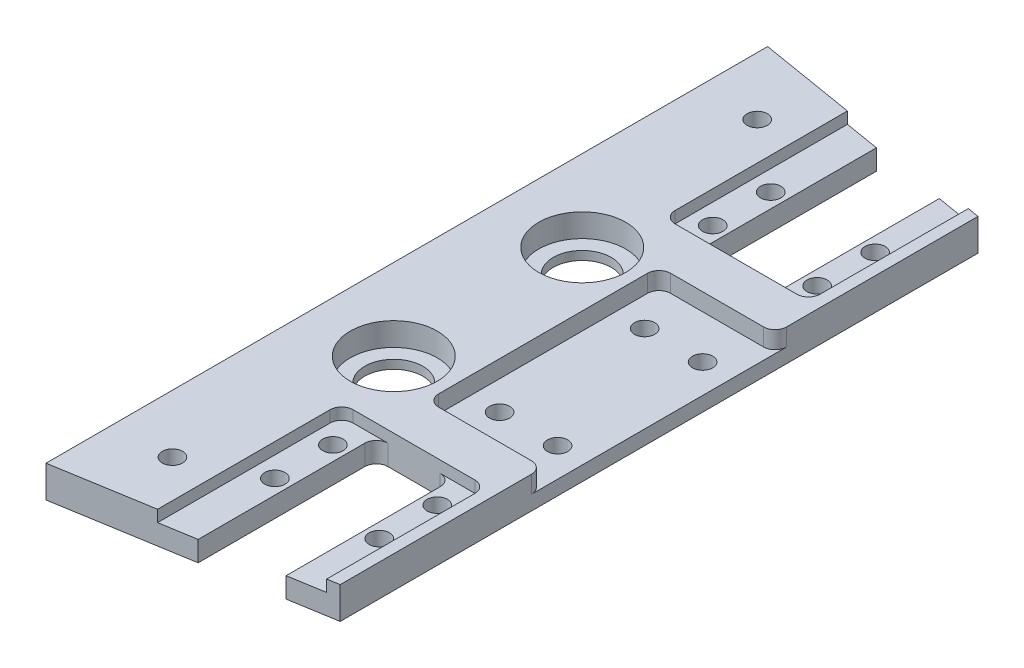
from build123d import *

# Parameters (mm, degrees)
SKETCH_1_W           = 35
SKETCH_1_H           = 55
EXTRUDE_1_DEPTH      = 1
EXTRUDE_2_DEPTH      = 3
SKETCH_3_R           = 5
CUT_EXTRUDE_1_DEPTH  = 169.569903897
SKETCH_4_R           = 4
CUT_EXTRUDE_2_DEPTH  = 2
SKETCH_5_R           = 2
CUT_EXTRUDE_3_DEPTH  = 2
EXTRUDE_START        = 7
EXTRUDE_3_DEPTH      = 7
CUT_EXTRUDE_START    = -1.5
SKETCH_9_W           = 10
SKETCH_9_H           = 26
CUT_EXTRUDE_4_DEPTH  = 168.318874833
SKETCH_10_R          = 1.5
CUT_EXTRUDE_5_DEPTH  = 194.595583627
EXTRUDE_START_2      = -3
EXTRUDE_4_DEPTH      = 3
SKETCH_12_R          = 9
SKETCH_12_R_2        = 5
EXTRUDE_5_DEPTH      = 2.5
SKETCH_13_R          = 7.5
CUT_EXTRUDE_6_DEPTH  = 4
SKETCH_14_W          = 10
SKETCH_14_H          = 26
CUT_EXTRUDE_7_DEPTH  = 2
EXTRUDE_START_3      = -1
EXTRUDE_6_DEPTH      = 2
CUT_EXTRUDE_8_DEPTH  = 170.92003224
SKETCH_17_W          = 35
SKETCH_17_H          = 55
CUT_EXTRUDE_9_DEPTH  = 1
SKETCH_19_R          = 9
EXTRUDE_8_DEPTH      = 2.5
SKETCH_20_W          = 13
SKETCH_20_H          = 1.5
EXTRUDE_9_DEPTH      = 5.5
SKETCH_21_R          = 3.5
CUT_EXTRUDE_10_DEPTH = 2
CUT_EXTRUDE_11_DEPTH = 10
SKETCH_23_R          = 1.75
CUT_EXTRUDE_12_DEPTH = 10
SKETCH_25_R          = 1.75
CUT_EXTRUDE_14_DEPTH = 170.71466453
SKETCH_26_R          = 1
CUT_EXTRUDE_15_DEPTH = 10
SKETCH_27_W          = 202.73966265
SKETCH_27_H          = 59.810399393
CUT_EXTRUDE_16_DEPTH = 188.307580884
SKETCH_28_W          = 40
SKETCH_28_H          = 3
CUT_EXTRUDE_17_DEPTH = 20
SKETCH_29_R          = 1.75
CUT_EXTRUDE_18_DEPTH = 10
EXTRUDE_START_4      = -5.5
EXTRUDE_10_DEPTH     = 5.5
FILLET_1_R           = 2
FILLET_3_R           = 2


with BuildPart() as part:
    # 草图1 → 凸台-拉伸1 (new body)
    with BuildSketch(Plane(origin=(0, 0, 0), x_dir=(1, 0, 0), z_dir=(0, 1, 0))):
        Rectangle(SKETCH_1_W, SKETCH_1_H)
    extrude(amount=EXTRUDE_1_DEPTH)

    # 草图2 → 凸台-拉伸2 (add)
    with BuildSketch(Plane(origin=(0, 1, 0), x_dir=(1, 0, 0), z_dir=(0, 1, 0))):
        with BuildLine():
            Line((106.75, -2.25), (106.75, 2.25))
            Line((106.75, 2.25), (121.75, 2.25))
            ThreePointArc((121.75, 2.25), (122.922125199, 2.352547667), (124.058635967, 2.65707481))
            Line((124.058635967, 2.65707481), (154.058635967, 13.576181838))
            ThreePointArc((154.058635967, 13.576181838), (158.397452333, 21.091232227), (151.75, 26.669107028))
            Line((151.75, 26.669107028), (-31.447415548, 57.101298968))
            ThreePointArc((-31.447415548, 57.101298968), (-37.800418235, 56.264673928), (-42.609265279, 52.029632639))
            Line((-42.609265279, 52.029632639), (-60.161792173, 23.605896086))
            ThreePointArc((-60.161792173, 23.605896086), (-61.717833724, 20.073278016), (-62.25, 16.25))
            Line((-62.25, 16.25), (-62.25, -16.25))
            ThreePointArc((-62.25, -16.25), (-61.717833724, -20.073278016), (-60.161792173, -23.605896086))
            Line((-60.161792173, -23.605896086), (-42.609265279, -52.029632639))
            ThreePointArc((-42.609265279, -52.029632639), (-37.800418235, -56.264673928), (-31.447415548, -57.101298968))
            Line((-31.447415548, -57.101298968), (151.75, -26.669107028))
            ThreePointArc((151.75, -26.669107028), (158.397452333, -21.091232227), (154.058635967, -13.576181838))
            Line((154.058635967, -13.576181838), (124.058635967, -2.65707481))
            ThreePointArc((124.058635967, -2.65707481), (122.922125199, -2.352547667), (121.75, -2.25))
            Line((121.75, -2.25), (106.75, -2.25))
        make_face()
    extrude(amount=EXTRUDE_2_DEPTH)

    # 草图3 → 切除-拉伸1 (cut, through all)
    with BuildSketch(Plane(origin=(0, 4, 0), x_dir=(1, 0, 0), z_dir=(0, 1, 0))):
        with Locations(Location((-48.25, 16.25, 0), (0, 0, 270))):
            Circle(SKETCH_3_R)
        with Locations(Location((-48.25, -16.25, 0), (0, 0, 270))):
            Circle(SKETCH_3_R)
    extrude(amount=-CUT_EXTRUDE_1_DEPTH, mode=Mode.SUBTRACT)

    # 草图4 → 切除-拉伸2 (cut)
    with BuildSketch(Plane(origin=(0, 4, 0), x_dir=(1, 0, 0), z_dir=(0, 1, 0))):
        with Locations(Location((-33.25, 46.25, 0), (0, 0, 270))):
            Circle(SKETCH_4_R)
        with Locations(Location((-33.25, -46.25, 0), (0, 0, 270))):
            Circle(SKETCH_4_R)
    extrude(amount=-CUT_EXTRUDE_2_DEPTH, mode=Mode.SUBTRACT)

    # 草图5 → 切除-拉伸3 (cut)
    with BuildSketch(Plane(origin=(0, 4, 0), x_dir=(1, 0, 0), z_dir=(0, 1, 0))):
        with Locations(Location((121.75, 9, 0), (0, 0, 270))):
            Circle(SKETCH_5_R)
        with Locations(Location((121.75, -9, 0), (0, 0, 270))):
            Circle(SKETCH_5_R)
        with Locations(Location((151.75, 19.919107028, 0), (0, 0, 270))):
            Circle(SKETCH_5_R)
        with Locations(Location((151.75, -19.919107028, 0), (0, 0, 270))):
            Circle(SKETCH_5_R)
    extrude(amount=-CUT_EXTRUDE_3_DEPTH, mode=Mode.SUBTRACT)

    # 草图8 → 凸台-拉伸3 (add)
    with BuildSketch(Plane.XZ.offset(-1).offset(EXTRUDE_START)):
        with BuildLine():
            Line((-26.75, -26.25), (-39.75, -26.25))
            Line((-39.75, -26.25), (-39.75, -55.124119675))
            ThreePointArc((-39.75, -55.124119675), (-35.798281322, -56.950759894), (-31.447415548, -57.101298968))
            Line((-31.447415548, -57.101298968), (-26.75, -56.320978726))
            Line((-26.75, -56.320978726), (-26.75, -26.25))
        make_face()
    extrude_3 = extrude(amount=-EXTRUDE_3_DEPTH)

    # 镜向1: 凸台-拉伸3 across plane
    add(extrude_3.mirror(Plane.XY))

    # 草图9 → 切除-拉伸4 (cut, through all)
    with BuildSketch(Plane.XZ.offset(6).offset(CUT_EXTRUDE_START)):
        with Locations((-33.25, -40.75)):
            Rectangle(SKETCH_9_W, SKETCH_9_H)
    cut_extrude_4 = extrude(amount=-CUT_EXTRUDE_4_DEPTH, mode=Mode.SUBTRACT)

    # 镜向2: 切除-拉伸4 across plane
    add(cut_extrude_4.mirror(Plane.XY), mode=Mode.SUBTRACT)

    # 草图10 → 切除-拉伸5 (cut, through all)
    with BuildSketch(Plane.XY.offset(-53.75)):
        with Locations((-33.25, -1.5)):
            Circle(SKETCH_10_R)
    cut_extrude_5 = extrude(amount=-CUT_EXTRUDE_5_DEPTH, mode=Mode.SUBTRACT)

    # 镜向3: 切除-拉伸5 across plane
    add(cut_extrude_5.mirror(Plane.XY), mode=Mode.SUBTRACT)

    # 草图11 → 凸台-拉伸4 (add)
    with BuildSketch(Plane(origin=(0, 4, 0), x_dir=(1, 0, 0), z_dir=(0, 1, 0)).offset(EXTRUDE_START_2)):
        with BuildLine():
            Line((-62.25, 50.419925161), (-62.25, 16.25))
            ThreePointArc((-62.25, 16.25), (-61.717833724, 20.073278016), (-60.161792173, 23.605896086))
            Line((-60.161792173, 23.605896086), (-42.609265279, 52.029632639))
            ThreePointArc((-42.609265279, 52.029632639), (-37.800418235, 56.264673928), (-31.447415548, 57.101298968))
            Line((-31.447415548, 57.101298968), (-50.611286861, 60.284742405))
            ThreePointArc((-50.611286861, 60.284742405), (-58.715789535, 58.048395892), (-62.25, 50.419925161))
        make_face()
        with BuildLine():
            ThreePointArc((-60.161792173, -23.605896086), (-61.717833724, -20.073278016), (-62.25, -16.25))
            Line((-62.25, -16.25), (-62.25, -50.419925161))
            ThreePointArc((-62.25, -50.419925161), (-58.715789535, -58.048395892), (-50.611286861, -60.284742405))
            Line((-50.611286861, -60.284742405), (-31.447415548, -57.101298968))
            ThreePointArc((-31.447415548, -57.101298968), (-37.800418235, -56.264673928), (-42.609265279, -52.029632639))
            Line((-42.609265279, -52.029632639), (-60.161792173, -23.605896086))
        make_face()
    extrude(amount=EXTRUDE_4_DEPTH)

    # 草图12 → 凸台-拉伸5 (add)
    # profile 1 of 2: a face of its own
    with BuildSketch(Plane.XZ.offset(-1)):
        with Locations(Location((-48.25, 16.25, 0), (0, 0, 90))):
            Circle(SKETCH_12_R)
        with Locations(Location((-48.25, 16.25, 0), (0, 0, 90))):
            Circle(SKETCH_12_R_2, mode=Mode.SUBTRACT)
    # profile 2 of 2: a face of its own
    with BuildSketch(Plane.XZ.offset(-1)):
        with Locations(Location((-48.25, -16.25, 0), (0, 0, 90))):
            Circle(SKETCH_12_R)
        with Locations(Location((-48.25, -16.25, 0), (0, 0, 90))):
            Circle(SKETCH_12_R_2, mode=Mode.SUBTRACT)
    extrude(amount=EXTRUDE_5_DEPTH)

    # 草图13 → 切除-拉伸6 (cut)
    with BuildSketch(Plane(origin=(0, 4, 0), x_dir=(1, 0, 0), z_dir=(0, 1, 0))):
        with Locations(Location((-48.25, 16.25, 0), (0, 0, 270))):
            Circle(SKETCH_13_R)
        with Locations(Location((-48.25, -16.25, 0), (0, 0, 270))):
            Circle(SKETCH_13_R)
    extrude(amount=-CUT_EXTRUDE_6_DEPTH, mode=Mode.SUBTRACT)

    # 草图14 → 切除-拉伸7 (cut)
    with BuildSketch(Plane(origin=(0, 4, 0), x_dir=(1, 0, 0), z_dir=(0, 1, 0))):
        with Locations((-33.25, 40.75)):
            Rectangle(SKETCH_14_W, SKETCH_14_H)
        Polygon((-20.75, 55.324277157), (-45.75, 59.477200364), (-45.75, 27.75), (-38.25, 27.75), (-38.25, 53.75), (-28.25, 53.75), (-28.25, 27.75), (-20.75, 27.75), align=None)
    cut_extrude_7 = extrude(amount=-CUT_EXTRUDE_7_DEPTH, mode=Mode.SUBTRACT)

    # 草图15 → 凸台-拉伸6 (add)
    with BuildSketch(Plane(origin=(0, 2, 0), x_dir=(1, 0, 0), z_dir=(0, 1, 0)).offset(EXTRUDE_START_3)):
        Polygon((-18.75, 54.9920433), (-47.75, 59.80943422), (-47.75, 25.75), (-30.25, 25.75), (-18.75, 25.75), align=None)
    extrude_6 = extrude(amount=-EXTRUDE_6_DEPTH)

    # 草图16 → 切除-拉伸8 (cut, through all)
    with BuildSketch(Plane.XZ.offset(6)):
        with BuildLine():
            Line((-31.447415548, -57.101298968), (-26.75, -56.320978726))
            Line((-26.75, -56.320978726), (-26.75, -26.25))
            Line((-26.75, -26.25), (-39.75, -26.25))
            Line((-39.75, -26.25), (-39.75, -55.124119675))
            ThreePointArc((-39.75, -55.124119675), (-35.798281322, -56.950759894), (-31.447415548, -57.101298968))
        make_face()
        with BuildLine():
            Line((-39.75, -65.953183835), (-26.75, -64.748478677))
            Line((-26.75, -64.748478677), (-26.75, -56.320978726))
            Line((-26.75, -56.320978726), (-31.447415548, -57.101298968))
            ThreePointArc((-31.447415548, -57.101298968), (-35.798281322, -56.950759894), (-39.75, -55.124119675))
            Line((-39.75, -55.124119675), (-39.75, -65.953183835))
        make_face()
    cut_extrude_8 = extrude(amount=-CUT_EXTRUDE_8_DEPTH, mode=Mode.SUBTRACT)

    # 镜向4: 切除-拉伸4, 切除-拉伸7, 凸台-拉伸6, 切除-拉伸8 across plane
    add(cut_extrude_4.mirror(Plane.XY), mode=Mode.SUBTRACT)
    add(cut_extrude_7.mirror(Plane.XY), mode=Mode.SUBTRACT)
    add(extrude_6.mirror(Plane.XY))
    add(cut_extrude_8.mirror(Plane.XY), mode=Mode.SUBTRACT)

    # 草图17 → 切除-拉伸9 (cut)
    with BuildSketch(Plane.XZ):
        Rectangle(SKETCH_17_W, SKETCH_17_H)
    extrude(amount=-CUT_EXTRUDE_9_DEPTH, mode=Mode.SUBTRACT)

    # 草图19 → 凸台-拉伸8 (add)
    # profile 1 of 3: a face of its own
    with BuildSketch(Plane.XZ.offset(-1)):
        with BuildLine():
            Line((-50.611286861, -60.284742405), (-47.75, -59.80943422))
            Line((-47.75, -59.80943422), (-47.75, -25.75))
            Line((-47.75, -25.75), (-18.75, -25.75))
            Line((-18.75, -25.75), (-18.75, 25.75))
            Line((-18.75, 25.75), (-47.75, 25.75))
            Line((-47.75, 25.75), (-47.75, 59.80943422))
            Line((-47.75, 59.80943422), (-50.611286861, 60.284742405))
            ThreePointArc((-50.611286861, 60.284742405), (-58.715789535, 58.048395892), (-62.25, 50.419925161))
            Line((-62.25, 50.419925161), (-62.25, -50.419925161))
            ThreePointArc((-62.25, -50.419925161), (-58.715789535, -58.048395892), (-50.611286861, -60.284742405))
        make_face()
        with Locations((-48.25, -16.25)):
            Circle(SKETCH_19_R, mode=Mode.SUBTRACT)
        with Locations((-48.25, 16.25)):
            Circle(SKETCH_19_R, mode=Mode.SUBTRACT)
    # profile 2 of 3: a face of its own
    with BuildSketch(Plane.XZ.offset(-1)):
        Polygon((-26.75, 56.320978726), (-26.75, 26.25), (-39.75, 26.25), (-39.75, 58.480498794), (-47.75, 59.80943422), (-47.75, 25.75), (-18.75, 25.75), (-18.75, 54.9920433), align=None)
    # profile 3 of 3: a face of its own
    with BuildSketch(Plane.XZ.offset(-1)):
        Polygon((-26.75, -26.25), (-26.75, -56.320978726), (-18.75, -54.9920433), (-18.75, -25.75), (-47.75, -25.75), (-47.75, -59.80943422), (-39.75, -58.480498794), (-39.75, -26.25), align=None)
    extrude(amount=EXTRUDE_8_DEPTH)

    # 草图20 → 凸台-拉伸9 (add)
    with BuildSketch(Plane(origin=(0, 4, 0), x_dir=(1, 0, 0), z_dir=(0, 1, 0))):
        with Locations((-33.25, 27)):
            Rectangle(SKETCH_20_W, SKETCH_20_H)
        with Locations((-33.25, -27)):
            Rectangle(SKETCH_20_W, SKETCH_20_H)
    extrude(amount=-EXTRUDE_9_DEPTH)

    # 草图21 → 切除-拉伸10 (cut)
    with BuildSketch(Plane(origin=(0, 4, 0), x_dir=(1, 0, 0), z_dir=(0, 1, 0))):
        with Locations(Location((121.75, 9, 0), (0, 0, 270))):
            Circle(SKETCH_21_R)
        with Locations(Location((121.75, -9, 0), (0, 0, 270))):
            Circle(SKETCH_21_R)
        with Locations(Location((151.75, -19.919107028, 0), (0, 0, 270))):
            Circle(SKETCH_21_R)
        with Locations(Location((151.75, 19.919107028, 0), (0, 0, 270))):
            Circle(SKETCH_21_R)
    extrude(amount=-CUT_EXTRUDE_10_DEPTH, mode=Mode.SUBTRACT)

    # 草图22 → 切除-拉伸11 (cut)
    with BuildSketch(Plane(origin=(0, 4, 0), x_dir=(1, 0, 0), z_dir=(0, 1, 0))):
        with BuildLine():
            ThreePointArc((5.75, -14.5), (7.5, -16.25), (5.75, -18))
            Line((5.75, -18), (1.75, -18))
            ThreePointArc((1.75, -18), (0, -16.25), (1.75, -14.5))
            Line((1.75, -14.5), (5.75, -14.5))
        make_face()
        with BuildLine():
            ThreePointArc((85.75, -14.5), (87.5, -16.25), (85.75, -18))
            Line((85.75, -18), (81.75, -18))
            ThreePointArc((81.75, -18), (80, -16.25), (81.75, -14.5))
            Line((81.75, -14.5), (85.75, -14.5))
        make_face()
        with BuildLine():
            Line((3.5, 31.25), (3.5, 35.25))
            ThreePointArc((3.5, 35.25), (1.75, 37), (0, 35.25))
            Line((0, 35.25), (0, 31.25))
            ThreePointArc((0, 31.25), (1.75, 29.5), (3.5, 31.25))
        make_face()
        with BuildLine():
            Line((7.5, 16.25), (0, 16.25))
            ThreePointArc((0, 16.25), (0.512563133, 15.012563133), (1.75, 14.5))
            Line((1.75, 14.5), (5.75, 14.5))
            ThreePointArc((5.75, 14.5), (6.987436867, 15.012563133), (7.5, 16.25))
        make_face()
        with BuildLine():
            Line((81.75, 14.5), (85.75, 14.5))
            ThreePointArc((85.75, 14.5), (87.5, 16.25), (85.75, 18))
            Line((85.75, 18), (81.75, 18))
            ThreePointArc((81.75, 18), (80, 16.25), (81.75, 14.5))
        make_face()
        with BuildLine():
            ThreePointArc((1.75, 18), (0.512563133, 17.487436867), (0, 16.25))
            Line((0, 16.25), (7.5, 16.25))
            ThreePointArc((7.5, 16.25), (6.987436867, 17.487436867), (5.75, 18))
            Line((5.75, 18), (1.75, 18))
        make_face()
        with BuildLine():
            Line((3.5, -31.25), (3.5, -35.25))
            ThreePointArc((3.5, -35.25), (1.75, -37), (0, -35.25))
            Line((0, -35.25), (0, -31.25))
            ThreePointArc((0, -31.25), (1.75, -29.5), (3.5, -31.25))
        make_face()
        with BuildLine():
            Line((41.75, -18), (45.75, -18))
            ThreePointArc((45.75, -18), (47.5, -16.25), (45.75, -14.5))
            Line((45.75, -14.5), (41.75, -14.5))
            ThreePointArc((41.75, -14.5), (40, -16.25), (41.75, -18))
        make_face()
        with BuildLine():
            Line((41.75, 14.5), (45.75, 14.5))
            ThreePointArc((45.75, 14.5), (47.5, 16.25), (45.75, 18))
            Line((45.75, 18), (41.75, 18))
            ThreePointArc((41.75, 18), (40, 16.25), (41.75, 14.5))
        make_face()
    extrude(amount=-CUT_EXTRUDE_11_DEPTH, mode=Mode.SUBTRACT)

    # 草图23 → 切除-拉伸12 (cut)
    with BuildSketch(Plane(origin=(0, 4, 0), x_dir=(1, 0, 0), z_dir=(0, 1, 0))):
        with Locations(Location((-42.25, 42.75, 0), (0, 0, 270))):
            Circle(SKETCH_23_R)
        with Locations(Location((-42.25, 32.75, 0), (0, 0, 270))):
            Circle(SKETCH_23_R)
        with Locations(Location((-24.25, 32.75, 0), (0, 0, 270))):
            Circle(SKETCH_23_R)
        with Locations(Location((-24.25, 42.75, 0), (0, 0, 270))):
            Circle(SKETCH_23_R)
    cut_extrude_12 = extrude(amount=-CUT_EXTRUDE_12_DEPTH, mode=Mode.SUBTRACT)

    # 镜向5: 切除-拉伸12 across plane
    add(cut_extrude_12.mirror(Plane.XY), mode=Mode.SUBTRACT)

    # 草图25 → 切除-拉伸14 (cut, through all)
    with BuildSketch(Plane(origin=(0, 4, 0), x_dir=(1, 0, 0), z_dir=(0, 1, 0))):
        with Locations(Location((-52.25, -50.419925161, 0), (0, 0, 270))):
            Circle(SKETCH_25_R)
        with Locations(Location((-52.25, 50.419925161, 0), (0, 0, 270))):
            Circle(SKETCH_25_R)
    extrude(amount=-CUT_EXTRUDE_14_DEPTH, mode=Mode.SUBTRACT)

    # 草图26 → 切除-拉伸15 (cut)
    with BuildSketch(Plane(origin=(0, 4, 0), x_dir=(1, 0, 0), z_dir=(0, 1, 0))):
        with Locations(Location((106.75, 25, 0), (0, 0, 270))):
            Circle(SKETCH_26_R)
    extrude(amount=-CUT_EXTRUDE_15_DEPTH, mode=Mode.SUBTRACT)

    # 草图27 → 切除-拉伸16 (cut, through all)
    with BuildSketch(Plane(origin=(-18.75, 0, 0), x_dir=(0, 0, -1), z_dir=(1, 0, 0))):
        with Locations((17.371402765, -5.55858944)):
            Rectangle(SKETCH_27_W, SKETCH_27_H)
    extrude(amount=CUT_EXTRUDE_16_DEPTH, mode=Mode.SUBTRACT)

    # 草图28 → 切除-拉伸17 (cut)
    with BuildSketch(Plane(origin=(-18.75, 0, 0), x_dir=(0, 0, -1), z_dir=(1, 0, 0))):
        with Locations((0, 2.5)):
            Rectangle(SKETCH_28_W, SKETCH_28_H)
    extrude(amount=-CUT_EXTRUDE_17_DEPTH, mode=Mode.SUBTRACT)

    # 草图29 → 切除-拉伸18 (cut)
    with BuildSketch(Plane(origin=(0, 1, 0), x_dir=(1, 0, 0), z_dir=(0, 1, 0))):
        with BuildLine():
            ThreePointArc((-25.5, 12.5), (-24.987436867, 11.262563133), (-23.75, 10.75))
            Line((-23.75, 10.75), (-23.75, 12.5))
            Line((-23.75, 12.5), (-25.5, 12.5))
        make_face()
        with BuildLine():
            Line((-23.75, 12.5), (-23.75, 10.75))
            ThreePointArc((-23.75, 10.75), (-22.512563133, 11.262563133), (-22, 12.5))
            ThreePointArc((-22, 12.5), (-23.75, 14.25), (-25.5, 12.5))
            Line((-25.5, 12.5), (-23.75, 12.5))
        make_face()
        with BuildLine():
            ThreePointArc((-22, -12.5), (-22.512563133, -11.262563133), (-23.75, -10.75))
            Line((-23.75, -10.75), (-23.75, -12.5))
            Line((-23.75, -12.5), (-25.5, -12.5))
            ThreePointArc((-25.5, -12.5), (-23.75, -14.25), (-22, -12.5))
        make_face()
        with BuildLine():
            Line((-23.75, -12.5), (-23.75, -10.75))
            ThreePointArc((-23.75, -10.75), (-24.987436867, -11.262563133), (-25.5, -12.5))
            Line((-25.5, -12.5), (-23.75, -12.5))
        make_face()
        with BuildLine():
            ThreePointArc((-32, -12.5), (-32.512563133, -11.262563133), (-33.75, -10.75))
            Line((-33.75, -10.75), (-33.75, -12.5))
            Line((-33.75, -12.5), (-32, -12.5))
        make_face()
        with BuildLine():
            Line((-33.75, -12.5), (-33.75, -10.75))
            ThreePointArc((-33.75, -10.75), (-34.987436867, -13.737436867), (-32, -12.5))
            Line((-32, -12.5), (-33.75, -12.5))
        make_face()
        with Locations(Location((-33.75, 12.5, 0), (0, 0, 270))):
            Circle(SKETCH_29_R)
    extrude(amount=-CUT_EXTRUDE_18_DEPTH, mode=Mode.SUBTRACT)

    # 草图30 → 凸台-拉伸10 (add)
    with BuildSketch(Plane(origin=(0, 4, 0), x_dir=(1, 0, 0), z_dir=(0, 1, 0)).offset(EXTRUDE_START_4)):
        with BuildLine():
            Line((-50.611286861, 60.284742405), (-62.25, 62.21812968))
            Line((-62.25, 62.21812968), (-62.25, 50.419925161))
            ThreePointArc((-62.25, 50.419925161), (-58.715789535, 58.048395892), (-50.611286861, 60.284742405))
        make_face()
        with BuildLine():
            Line((-50.611286861, -60.284742405), (-62.25, -62.21812968))
            Line((-62.25, -62.21812968), (-62.25, -50.419925161))
            ThreePointArc((-62.25, -50.419925161), (-58.715789535, -58.048395892), (-50.611286861, -60.284742405))
        make_face()
    extrude(amount=EXTRUDE_10_DEPTH)

    # 圆角1
    fillet_1_edges = [part.edges().sort_by_distance(p)[0] for p in [
        (-38.75, 2.5, -20),
        (-38.75, 2.5, 20),
        (-20.75, 3, -27.75),
        (-45.75, 3, -27.75),
        (-45.75, 3, 27.75),
        (-20.75, 3, 27.75),
        (-39.75, 0.25, -27.75),
        (-26.75, 0.25, -27.75),
        (-26.75, 0.25, 27.75),
        (-39.75, 0.25, 27.75),
    ]]
    fillet(fillet_1_edges, radius=FILLET_1_R)

    # 圆角3
    fillet_3_edges = [part.edges().sort_by_distance(p)[0] for p in [
        (-18.75, 2.5, -20),
        (-18.75, 2.5, 20),
    ]]
    fillet(fillet_3_edges, radius=FILLET_3_R)


solid = part.part
